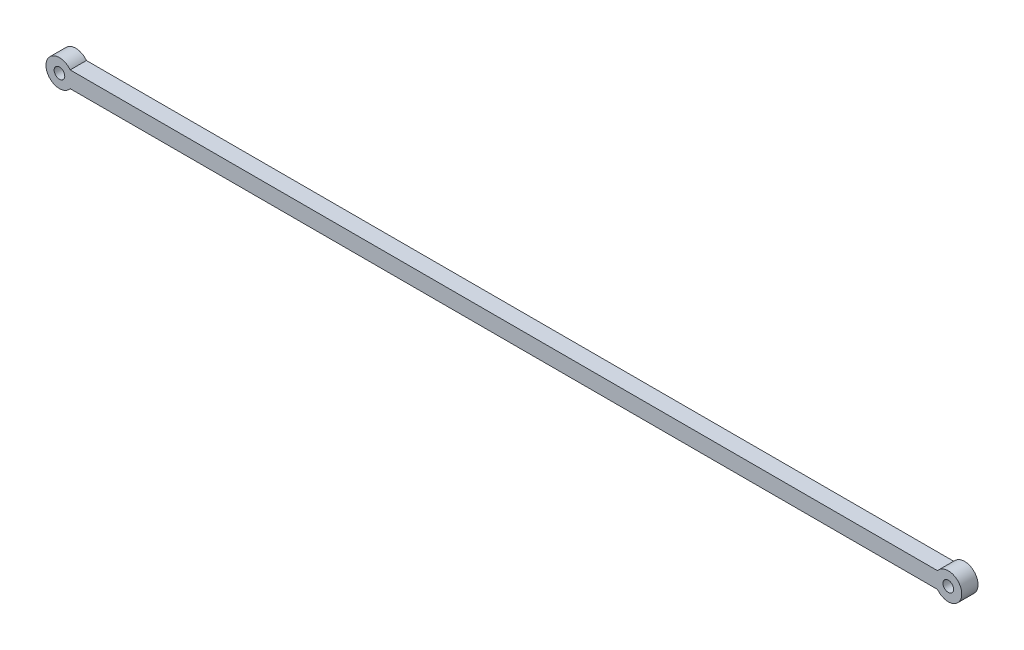
from build123d import *

# Parameters (mm, degrees)
SKETCH3_R           = 18.15695
SKETCH3_W           = 1171.0727278
SKETCH3_H           = 21.9525
BOSS_EXTRUDE1_DEPTH = 10.97625
SKETCH4_R           = 7.1807
CUT_EXTRUDE1_DEPTH  = 645.139348927


with BuildPart() as part:
    # Sketch3 → Boss-Extrude1 (new, symmetric)
    with BuildSketch(Plane.XY):
        with Locations((-625.352112676, 0)):
            Circle(SKETCH3_R)
        with Locations((574.647887324, 0)):
            Circle(SKETCH3_R)
        with Locations((-25.352112676, 0)):
            Rectangle(SKETCH3_W, SKETCH3_H)
    extrude(amount=BOSS_EXTRUDE1_DEPTH, both=True)

    # Sketch4 → Cut-Extrude1 (cut, through all)
    with BuildSketch(Plane.XY.offset(10.97625)):
        with Locations((-625.352112676, 0)):
            Circle(SKETCH4_R)
        with Locations((574.647887324, 0)):
            Circle(SKETCH4_R)
    extrude(amount=-CUT_EXTRUDE1_DEPTH, mode=Mode.SUBTRACT)


solid = part.part
